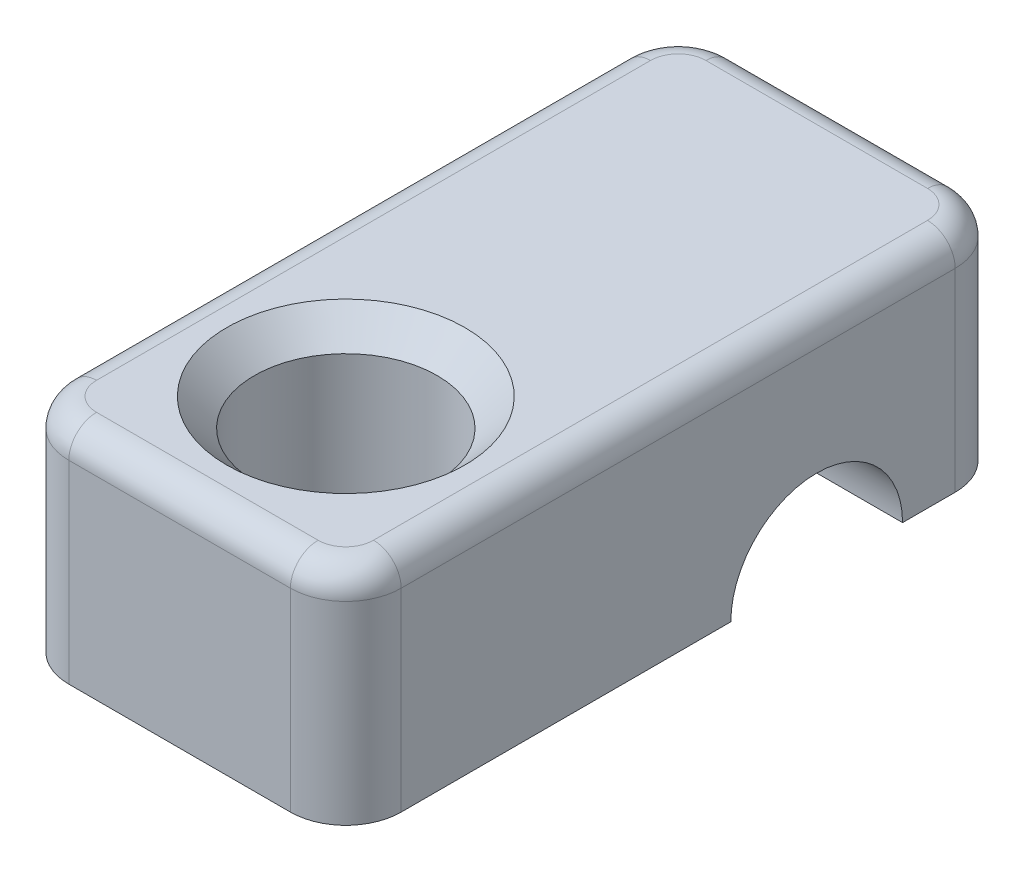
from build123d import *

# Parameters (mm, degrees)
EXTRUDE_1_DEPTH     = 6
SKETCH_2_R          = 1.65
CUT_EXTRUDE_1_DEPTH = 6
FILLET_1_R          = 1
CHAMFER_1_SIZE      = 0.5
FILLET_2_R          = 0.5


with BuildPart() as part:
    # 草圖1 → 填料-伸長1 (new body)
    with BuildSketch(Plane(origin=(0, 0, 0), x_dir=(0, 0, -1), z_dir=(1, 0, 0))):
        with BuildLine():
            Line((0, 0), (6.95, 0))
            ThreePointArc((6.95, 0), (8.5, 1.55), (10.05, 0))
            Line((10.05, 0), (12, 0))
            Line((12, 0), (12, 4))
            Line((12, 4), (0, 4))
            Line((0, 4), (0, 0))
        make_face()
    extrude(amount=EXTRUDE_1_DEPTH)

    # 草圖2 → 除料-伸長1 (cut)
    with BuildSketch(Plane(origin=(0, 0, 0), x_dir=(-1, 0, 0), z_dir=(0, -1, 0))):
        with Locations(Location((-3, 3, 0), (0, 0, 90))):
            Circle(SKETCH_2_R)
    extrude(amount=-CUT_EXTRUDE_1_DEPTH, mode=Mode.SUBTRACT)

    # 圓角1
    fillet_1_edges = [part.edges().sort_by_distance(p)[0] for p in [
        (6, 2, -12),
        (6, 2, 0),
        (0, 2, -12),
        (0, 2, 0),
    ]]
    fillet(fillet_1_edges, radius=FILLET_1_R)

    # 導角1
    chamfer_1_edges = [part.edges().sort_by_distance(p)[0] for p in [
        (3, 4, -1.35),
    ]]
    chamfer(chamfer_1_edges, length=CHAMFER_1_SIZE)

    # 圓角2
    fillet_2_edges = [part.edges().sort_by_distance(p)[0] for p in [
        (6, 4, -6),
        (0, 4, -6),
        (3, 4, 0),
        (3, 4, -12),
        (0.292893219, 4, -0.292893219),
        (5.707106781, 4, -0.292893219),
        (0.292893219, 4, -11.707106781),
        (5.707106781, 4, -11.707106781),
    ]]
    fillet(fillet_2_edges, radius=FILLET_2_R)


solid = part.part
